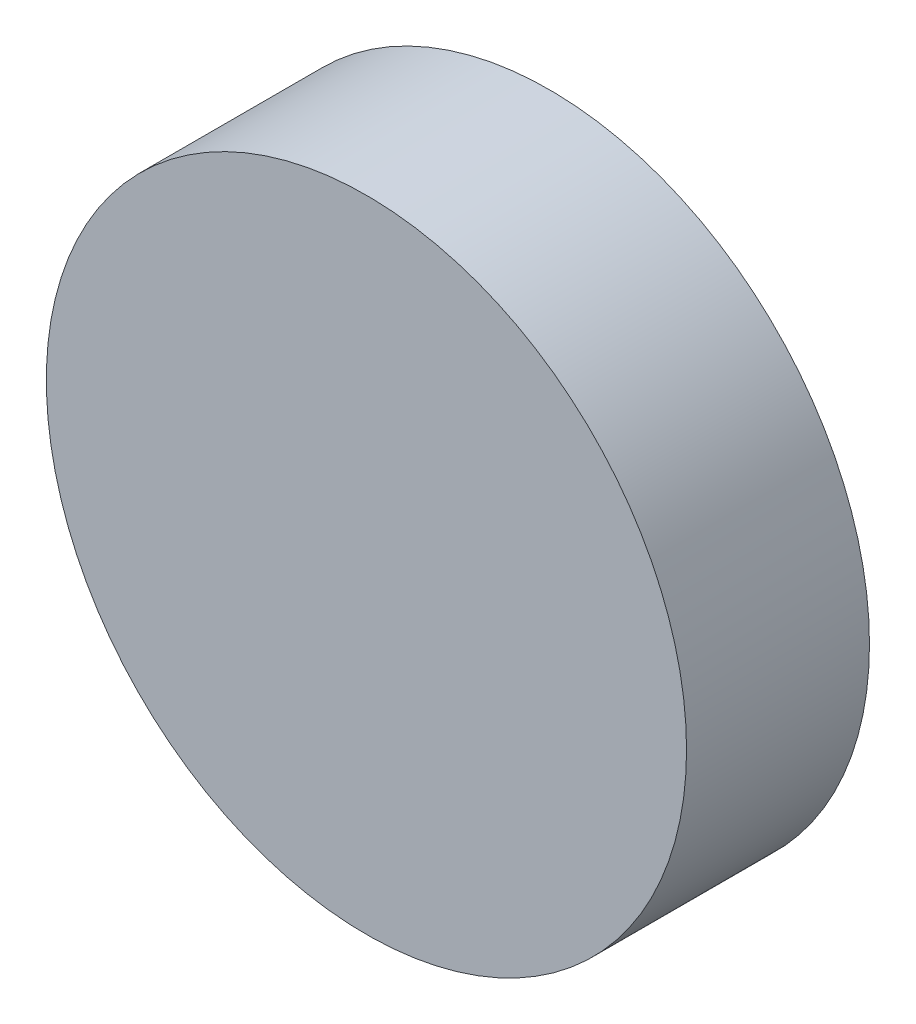
from build123d import *

# Parameters (mm, degrees)
SKETCH_1_R      = 70
EXTRUDE_1_DEPTH = 40


with BuildPart() as part:
    # 草图1 → 凸台-拉伸1 (new body)
    with BuildSketch(Plane.XY):
        Circle(SKETCH_1_R)
    extrude(amount=EXTRUDE_1_DEPTH)


solid = part.part
